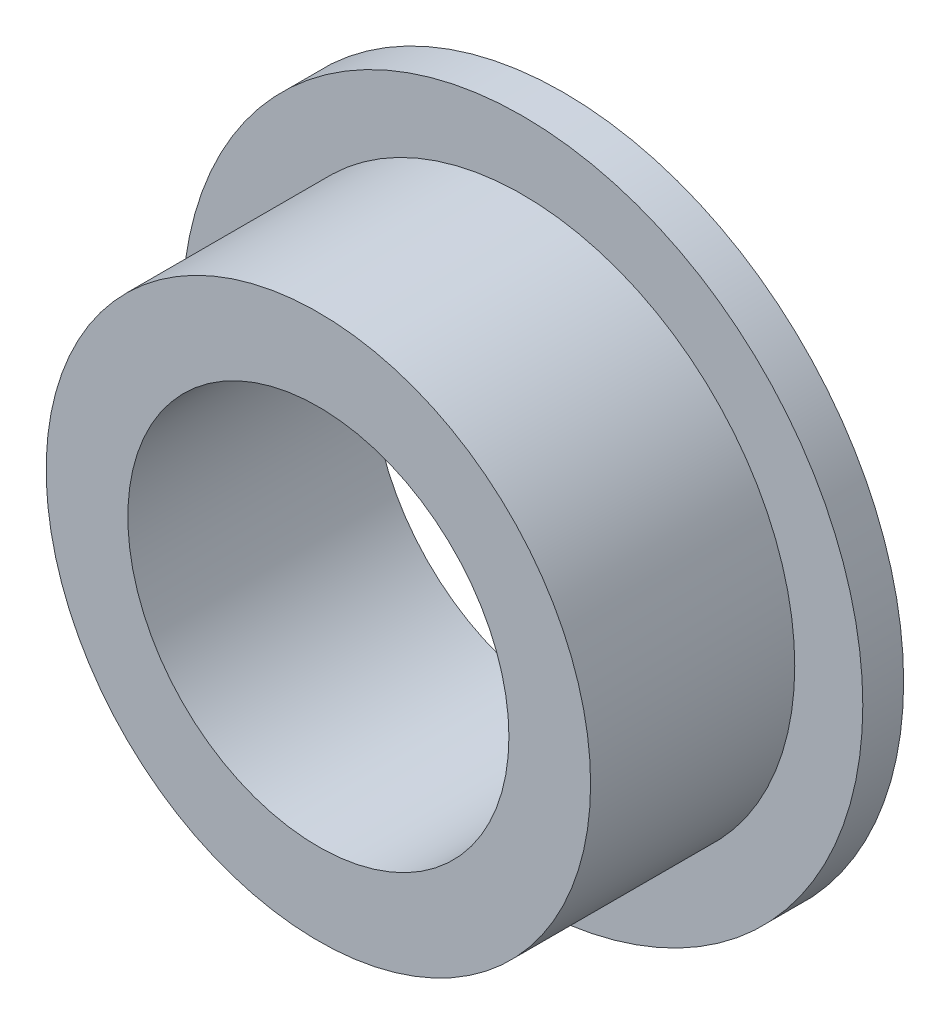
from build123d import *

# Parameters (mm, degrees)
SKETCH1_R           = 2.5
SKETCH1_R_2         = 1.4
BOSS_EXTRUDE1_DEPTH = 0.3
SKETCH2_R           = 2
SKETCH2_R_2         = 1.4
BOSS_EXTRUDE2_DEPTH = 1.5


with BuildPart() as part:
    # Sketch1 → Boss-Extrude1 (new body)
    with BuildSketch(Plane.XY):
        Circle(SKETCH1_R)
        Circle(SKETCH1_R_2, mode=Mode.SUBTRACT)
    extrude(amount=BOSS_EXTRUDE1_DEPTH)

    # Sketch2 → Boss-Extrude2 (add)
    with BuildSketch(Plane.XY.offset(0.3)):
        Circle(SKETCH2_R)
        Circle(SKETCH2_R_2, mode=Mode.SUBTRACT)
    extrude(amount=BOSS_EXTRUDE2_DEPTH)


solid = part.part
